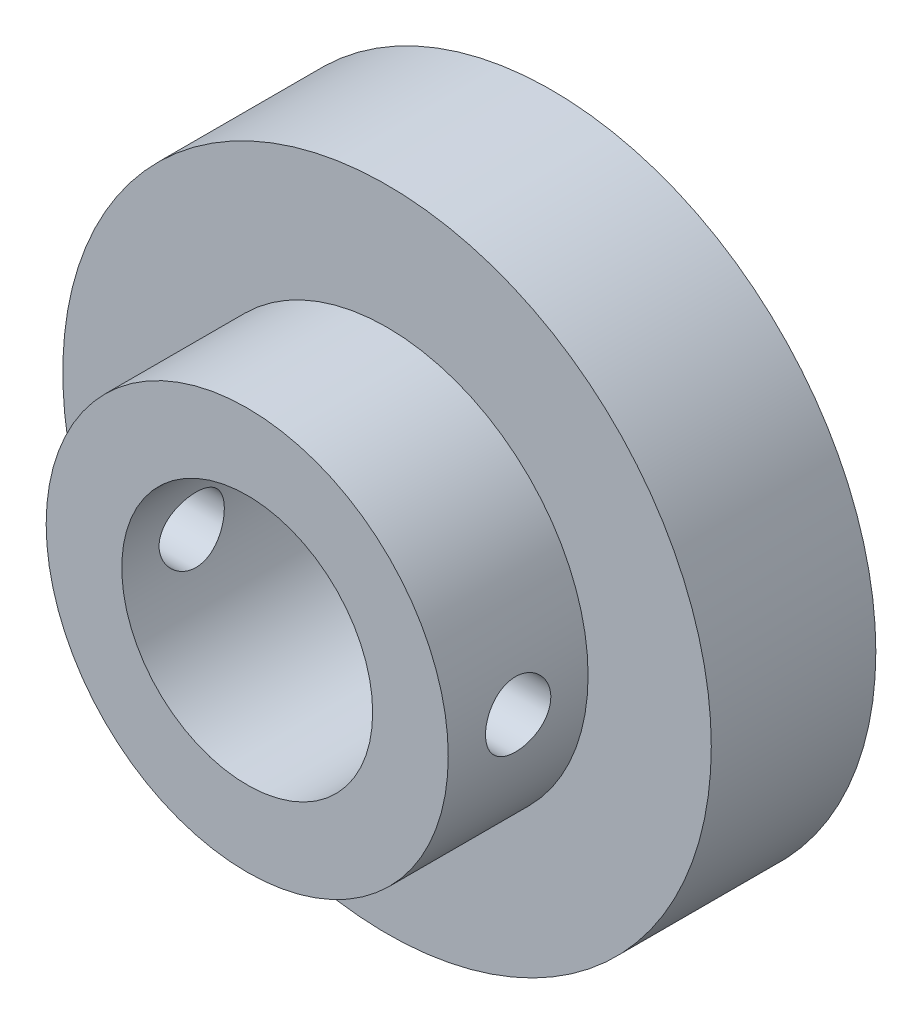
from build123d import *

# Parameters (mm, degrees)
SKETCH1_R               = 20.87
BOSS_EXTRUDE1_DEPTH     = 10.59
SKETCH2_R               = 12.94
BOSS_EXTRUDE2_DEPTH     = 9
CUT_EXTRUDE1_DEPTH      = 36.424312273
CUT_EXTRUDE1_DEPTH_BACK = 36.424312273
SKETCH3_R               = 8.075
CUT_EXTRUDE2_DEPTH      = 36.424312273
CUT_EXTRUDE2_DEPTH_BACK = 36.424312273
SKETCH4_R               = 2.1


with BuildPart() as part:
    # Sketch1 → Boss-Extrude1 (new body)
    with BuildSketch(Plane(origin=(0, 0, 0), x_dir=(0, 1, 0), z_dir=(0, 0, 1))):
        with Locations(Location((0, 0, 0), (0, 0, 270))):
            Circle(SKETCH1_R)
    extrude(amount=BOSS_EXTRUDE1_DEPTH)

    # Sketch2 → Boss-Extrude2 (add)
    with BuildSketch(Plane.XY.offset(10.59)):
        Circle(SKETCH2_R)
    extrude(amount=BOSS_EXTRUDE2_DEPTH)

    # Sketch3 → Cut-Extrude1 (cut, two sides: drawn at the far end of the back side and taken through both)
    with BuildSketch(Plane.XY.offset(19.59).offset(-CUT_EXTRUDE1_DEPTH_BACK)):
        Circle(SKETCH3_R)
    extrude(amount=CUT_EXTRUDE1_DEPTH + CUT_EXTRUDE1_DEPTH_BACK, mode=Mode.SUBTRACT)

    # Sketch4 → Cut-Extrude2 (cut, two sides: drawn at the far end of the back side and taken through both)
    with BuildSketch(Plane.YZ.offset(-CUT_EXTRUDE2_DEPTH_BACK)):
        with Locations(Location((0, 15.09, 0), (0, 0, 270))):
            Circle(SKETCH4_R)
    extrude(amount=CUT_EXTRUDE2_DEPTH + CUT_EXTRUDE2_DEPTH_BACK, mode=Mode.SUBTRACT)


solid = part.part
